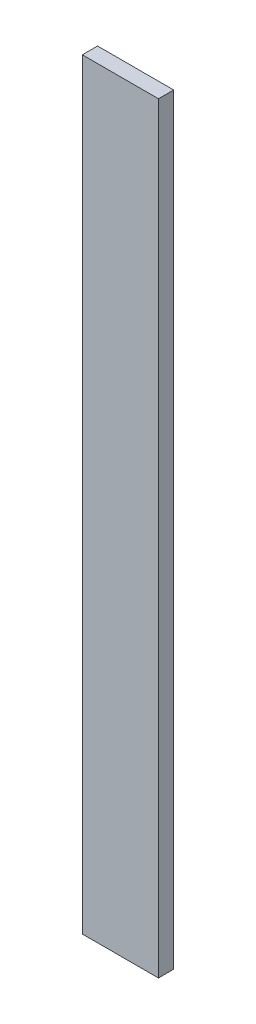
from build123d import *

# Parameters (mm, degrees)
SKETCH1_W           = 50
SKETCH1_H           = 10
BOSS_EXTRUDE1_DEPTH = 500


with BuildPart() as part:
    # Sketch1 → Boss-Extrude1 (new body)
    with BuildSketch(Plane(origin=(0, 0, 0), x_dir=(1, 0, 0), z_dir=(0, 1, 0))):
        Rectangle(SKETCH1_W, SKETCH1_H)
    extrude(amount=BOSS_EXTRUDE1_DEPTH)


solid = part.part
